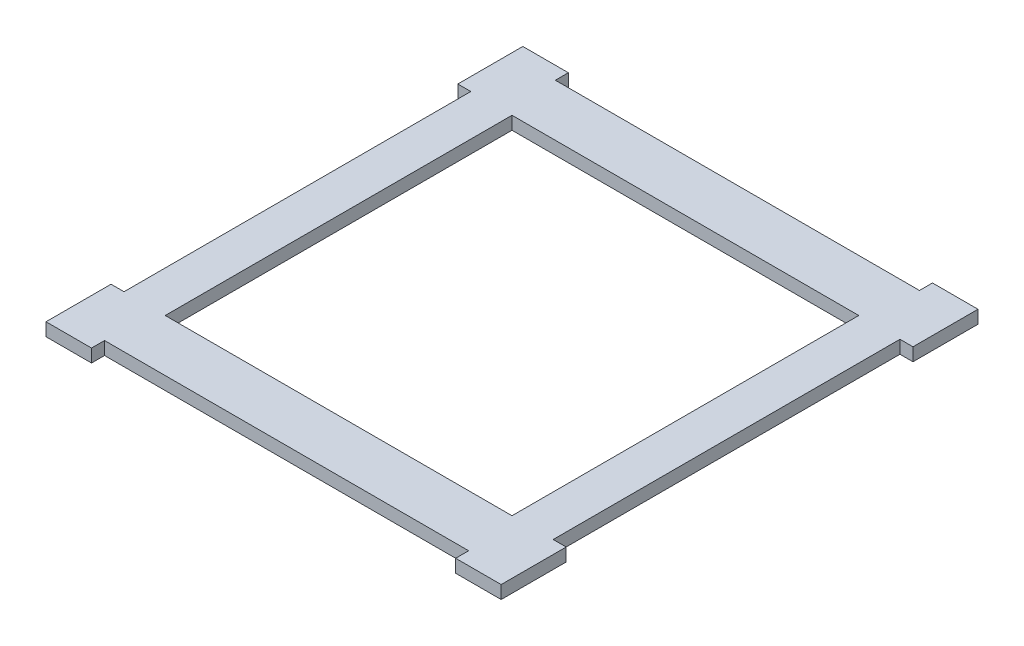
from build123d import *

# Parameters (mm, degrees)
SKETCH2_W               = 109
SKETCH2_H               = 104
SKETCH2_W_2             = 80
SKETCH2_H_2             = 80
BOSS_EXTRUDE2_DEPTH     = 3
SKETCH3_W               = 12.5
SKETCH3_H               = 3
BOSS_EXTRUDE3_DEPTH     = 5
SKETCH4_W               = 5
SKETCH4_H               = 80
CUT_EXTRUDE1_DEPTH      = 5
SKETCH5_W               = 10.5
SKETCH5_H               = 2
CUT_EXTRUDE2_DEPTH      = 10
MIRROR5_COPY_1_SKETCH_W = 10.5
MIRROR5_COPY_1_SKETCH_H = 2
MIRROR5_COPY_1_DEPTH    = 10


with BuildPart() as part:
    # Sketch2 → Boss-Extrude2 (new body)
    with BuildSketch(Plane(origin=(0, 0, 0), x_dir=(1, 0, 0), z_dir=(0, 1, 0))):
        Rectangle(SKETCH2_W, SKETCH2_H)
        Rectangle(SKETCH2_W_2, SKETCH2_H_2, mode=Mode.SUBTRACT)
    extrude(amount=BOSS_EXTRUDE2_DEPTH)

    # Sketch3 → Boss-Extrude3 (add)
    with BuildSketch(Plane(origin=(0, 0, -52), x_dir=(-1, 0, 0), z_dir=(0, 0, -1))):
        with Locations((48.25, 1.5)):
            Rectangle(SKETCH3_W, SKETCH3_H)
    extrude(amount=BOSS_EXTRUDE3_DEPTH)

    # Mirror1: part across plane


with BuildPart() as part_1:
    add(part.part)
    add(part.part.mirror(Plane.XY))

    # Mirror2: part across plane


with BuildPart() as part_2:
    add(part_1.part)
    add(part_1.part.mirror(Plane(origin=(0, 0, 0), x_dir=(0, 0, 1), z_dir=(1, 0, 0))))

    # Sketch4 → Cut-Extrude1 (cut)
    with BuildSketch(Plane.XZ):
        with Locations((-52, 0)):
            Rectangle(SKETCH4_W, SKETCH4_H)
    cut_extrude1 = extrude(amount=-CUT_EXTRUDE1_DEPTH, mode=Mode.SUBTRACT)

    # Mirror3: Cut-Extrude1 across plane
    add(cut_extrude1.mirror(Plane(origin=(0, 0, 0), x_dir=(0, 0, 1), z_dir=(1, 0, 0))), mode=Mode.SUBTRACT)

    # Sketch5 → Cut-Extrude2 (cut)
    with BuildSketch(Plane.XZ):
        with Locations((47.25, -56)):
            Rectangle(SKETCH5_W, SKETCH5_H)
        Polygon((54.5, -57), (54.5, -40), (52.5, -40), (52.5, -55), (52.5, -57), align=None)
    cut_extrude2 = extrude(amount=-CUT_EXTRUDE2_DEPTH, mode=Mode.SUBTRACT)

    # Mirror4: Cut-Extrude2 across plane
    add(cut_extrude2.mirror(Plane(origin=(0, 0, 0), x_dir=(0, 0, 1), z_dir=(1, 0, 0))), mode=Mode.SUBTRACT)

    # Mirror5: Cut-Extrude2 across plane
    add(cut_extrude2.mirror(Plane.XY), mode=Mode.SUBTRACT)

    # Mirror5 copy 1 sketch → Mirror5 copy 1 (cut)
    with BuildSketch(Plane(origin=(0, 0, 0), x_dir=(-1, 0, 0), z_dir=(0, -1, 0))):
        with Locations((47.25, -56)):
            Rectangle(MIRROR5_COPY_1_SKETCH_W, MIRROR5_COPY_1_SKETCH_H)
        Polygon((54.5, -57), (54.5, -40), (52.5, -40), (52.5, -55), (52.5, -57), align=None)
    extrude(amount=-MIRROR5_COPY_1_DEPTH, mode=Mode.SUBTRACT)


solid = part_2.part
